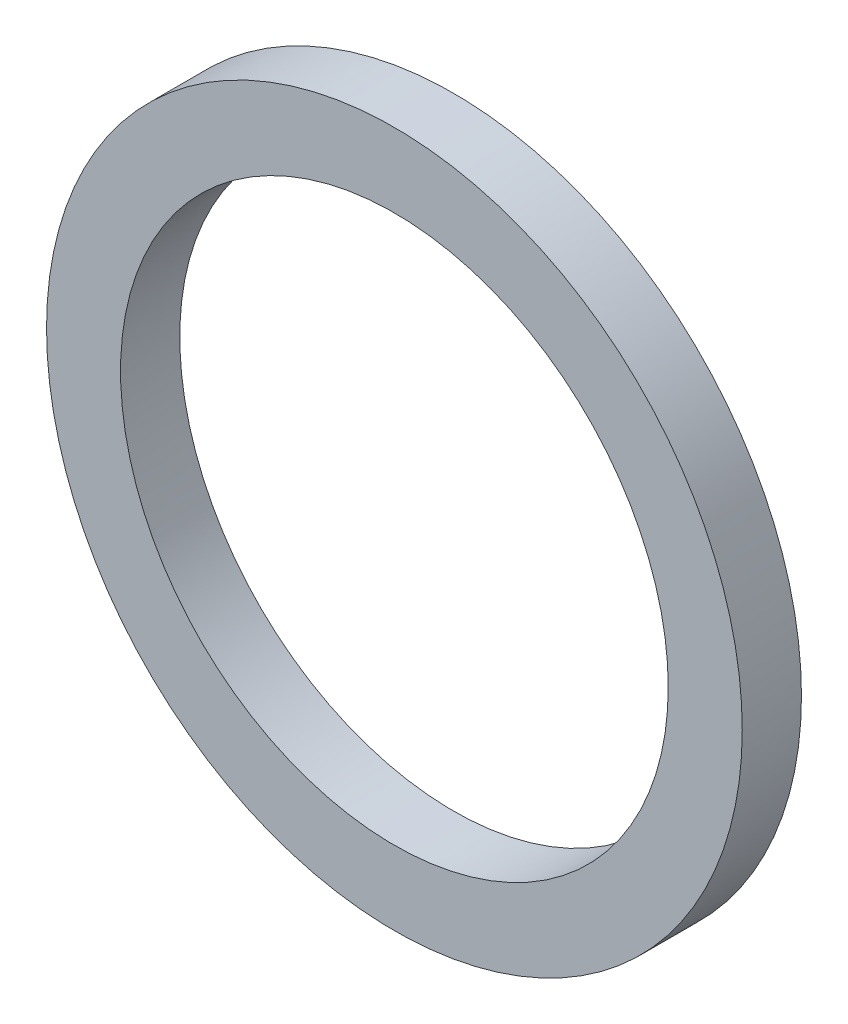
from build123d import *

# Parameters (mm, degrees)
SKETCH1_R           = 23.5
SKETCH1_R_2         = 18.5
BOSS_EXTRUDE1_DEPTH = 4


with BuildPart() as part:
    # Sketch1 → Boss-Extrude1 (new body)
    with BuildSketch(Plane.XY):
        Circle(SKETCH1_R)
        Circle(SKETCH1_R_2, mode=Mode.SUBTRACT)
    extrude(amount=BOSS_EXTRUDE1_DEPTH)


solid = part.part
